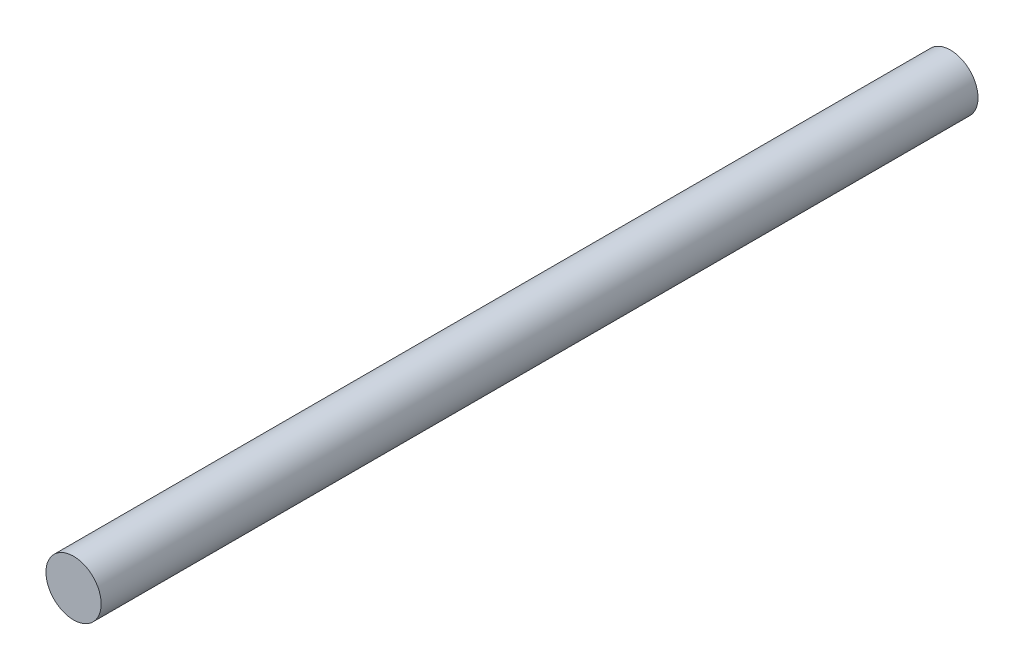
from build123d import *

# Parameters (mm, degrees)
SKETCH1_R           = 2
BOSS_EXTRUDE1_DEPTH = 31.75


with BuildPart() as part:
    # Sketch1 → Boss-Extrude1 (new, symmetric)
    with BuildSketch(Plane.XY):
        Circle(SKETCH1_R)
    extrude(amount=BOSS_EXTRUDE1_DEPTH, both=True)


solid = part.part
